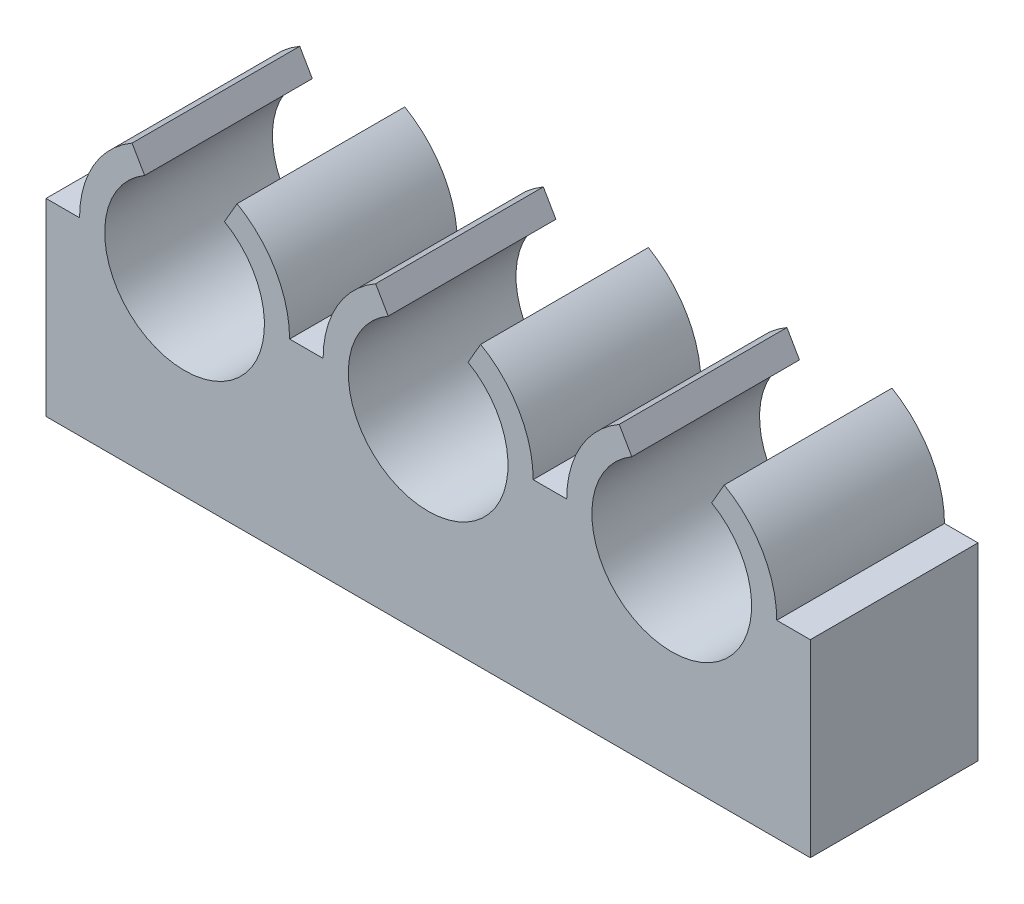
from build123d import *

# Parameters (mm, degrees)
BOSS_EXTRUDE1_DEPTH = 10


with BuildPart() as part:
    # Sketch4 → Boss-Extrude1 (new body)
    with BuildSketch(Plane.XY):
        with BuildLine():
            Line((-20.7875, 0), (-22.7875, 0))
            Line((-22.7875, 0), (-22.7875, -11.2625))
            Line((-22.7875, -11.2625), (22.7875, -11.2625))
            Line((22.7875, -11.2625), (22.7875, 0))
            Line((22.7875, 0), (20.7875, 0))
            ThreePointArc((20.7875, 0), (19.948484091, 3.13125), (17.65625, 5.423484091))
            Line((17.65625, 5.423484091), (16.90625, 4.124445986))
            ThreePointArc((16.90625, 4.124445986), (14.525, -4.7625), (12.14375, 4.124445986))
            Line((12.14375, 4.124445986), (11.39375, 5.423484091))
            ThreePointArc((11.39375, 5.423484091), (9.101515909, 3.13125), (8.2625, 0))
            Line((8.2625, 0), (6.2625, 0))
            ThreePointArc((6.2625, 0), (5.423484091, 3.13125), (3.13125, 5.423484091))
            Line((3.13125, 5.423484091), (2.38125, 4.124445986))
            ThreePointArc((2.38125, 4.124445986), (0, -4.7625), (-2.38125, 4.124445986))
            Line((-2.38125, 4.124445986), (-3.13125, 5.423484091))
            ThreePointArc((-3.13125, 5.423484091), (-5.423484091, 3.13125), (-6.2625, 0))
            Line((-6.2625, 0), (-8.2625, 0))
            ThreePointArc((-8.2625, 0), (-9.101515909, 3.13125), (-11.39375, 5.423484091))
            Line((-11.39375, 5.423484091), (-12.14375, 4.124445986))
            ThreePointArc((-12.14375, 4.124445986), (-14.525, -4.7625), (-16.90625, 4.124445986))
            Line((-16.90625, 4.124445986), (-17.65625, 5.423484091))
            ThreePointArc((-17.65625, 5.423484091), (-19.948484091, 3.13125), (-20.7875, 0))
        make_face()
    extrude(amount=BOSS_EXTRUDE1_DEPTH)


solid = part.part
